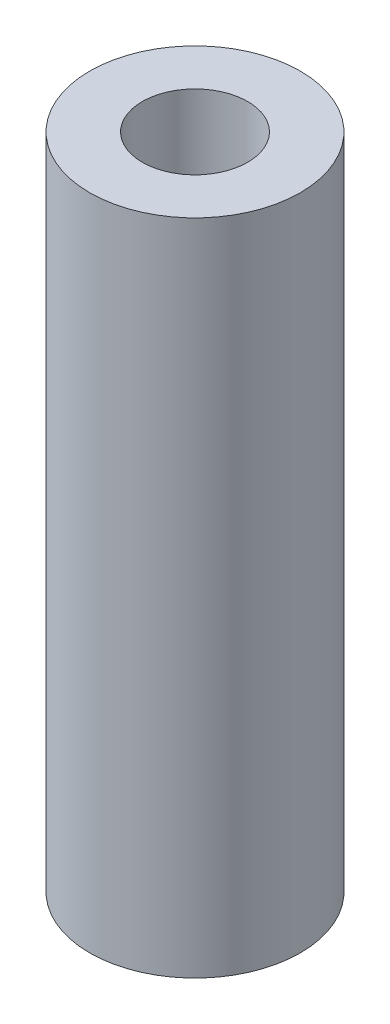
from build123d import *

# Parameters (mm, degrees)
SKETCH1_R           = 4
SKETCH1_R_2         = 2
BOSS_EXTRUDE1_DEPTH = 25


with BuildPart() as part:
    # Sketch1 → Boss-Extrude1 (new body)
    with BuildSketch(Plane(origin=(0, 0, 0), x_dir=(1, 0, 0), z_dir=(0, 1, 0))):
        with Locations(Location((0, 0, 0), (0, 0, 270))):
            Circle(SKETCH1_R)
        with Locations(Location((0, 0, 0), (0, 0, 270))):
            Circle(SKETCH1_R_2, mode=Mode.SUBTRACT)
    extrude(amount=BOSS_EXTRUDE1_DEPTH)


solid = part.part
